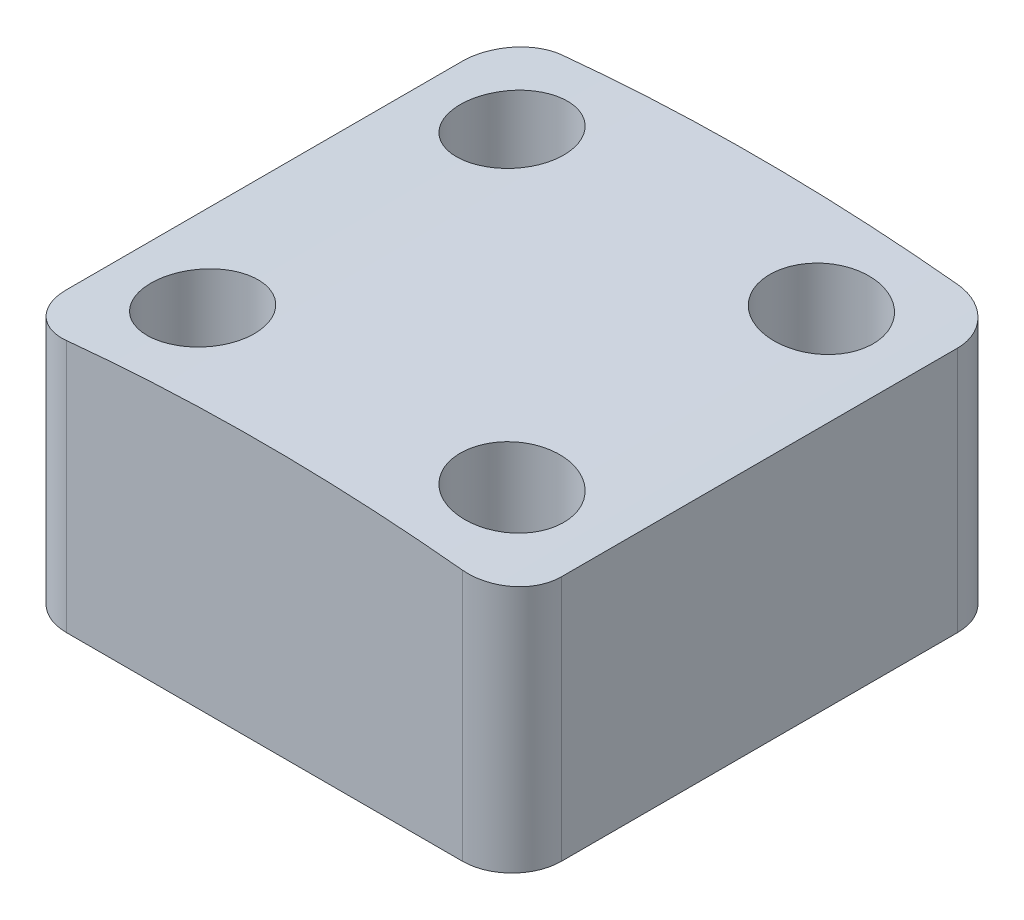
from build123d import *

# Parameters (mm, degrees)
BOSS_EXTRUDE1_DEPTH             = 12.7
BOSS_EXTRUDE1_DEPTH_BACK        = 12.7
F_1_4_0_25_DIAMETER_SLOT1_D     = 6.35
F_1_4_0_25_DIAMETER_SLOT1_DEPTH = 9.652
F_1_4_0_25_DIAMETER_SLOT1_TIP   = 1.907732465
F_4_0_209_DIAMETER_SLOT1_D      = 5.3086
F_4_0_209_DIAMETER_SLOT1_DEPTH  = 13.462
F_4_0_209_DIAMETER_SLOT1_TIP    = 1.594864341
FILLET1_R                       = 2.54


with BuildPart() as part:
    # Sketch1 → Boss-Extrude1 (new, two sides: drawn at the far end of the back side and taken through both)
    with BuildSketch(Plane.XY.offset(-BOSS_EXTRUDE1_DEPTH_BACK)):
        with BuildLine():
            Line((-12.701329683, 100.803292467), (-12.701329683, 88.103292467))
            Line((-12.701329683, 88.103292467), (12.698670317, 88.103292467))
            Line((12.698670317, 88.103292467), (12.698670317, 100.749441262))
            ThreePointArc((12.698670317, 100.749441262), (0.000359797, 101.573243718), (-12.701329683, 100.803292467))
        make_face()
    extrude(amount=BOSS_EXTRUDE1_DEPTH + BOSS_EXTRUDE1_DEPTH_BACK)

    # 1/4 (0.25) Diameter Slot1
    with Locations(Plane(origin=(0, 88.103292467, 0), x_dir=(-1, 0, 0), z_dir=(0, -1, 0))):
        with Locations((0, 0)):
            Hole(F_1_4_0_25_DIAMETER_SLOT1_D / 2, depth=F_1_4_0_25_DIAMETER_SLOT1_DEPTH)
            with Locations((0, 0, -(F_1_4_0_25_DIAMETER_SLOT1_DEPTH + F_1_4_0_25_DIAMETER_SLOT1_TIP / 2))):  # 118° drill point
                Cone(0, F_1_4_0_25_DIAMETER_SLOT1_D / 2, F_1_4_0_25_DIAMETER_SLOT1_TIP, mode=Mode.SUBTRACT)

    # #4 (0.209) Diameter Slot1
    with Locations(Plane(origin=(0, 88.103292467, 0), x_dir=(-1, 0, 0), z_dir=(0, -1, 0))):
        with Locations((-7.9375, -7.9375), (-7.9375, 7.9375), (7.9375, 7.9375), (7.9375, -7.9375)):
            Hole(F_4_0_209_DIAMETER_SLOT1_D / 2, depth=F_4_0_209_DIAMETER_SLOT1_DEPTH)
            with Locations((0, 0, -(F_4_0_209_DIAMETER_SLOT1_DEPTH + F_4_0_209_DIAMETER_SLOT1_TIP / 2))):  # 118° drill point
                Cone(0, F_4_0_209_DIAMETER_SLOT1_D / 2, F_4_0_209_DIAMETER_SLOT1_TIP, mode=Mode.SUBTRACT)

    # Fillet1
    fillet1_edges = [part.edges().sort_by_distance(p)[0] for p in [
        (-12.701329683, 94.453292467, 12.7),
        (12.698670317, 94.426366864, -12.7),
        (12.698670317, 94.426366864, 12.7),
        (-12.701329683, 94.453292467, -12.7),
    ]]
    fillet(fillet1_edges, radius=FILLET1_R)


solid = part.part
